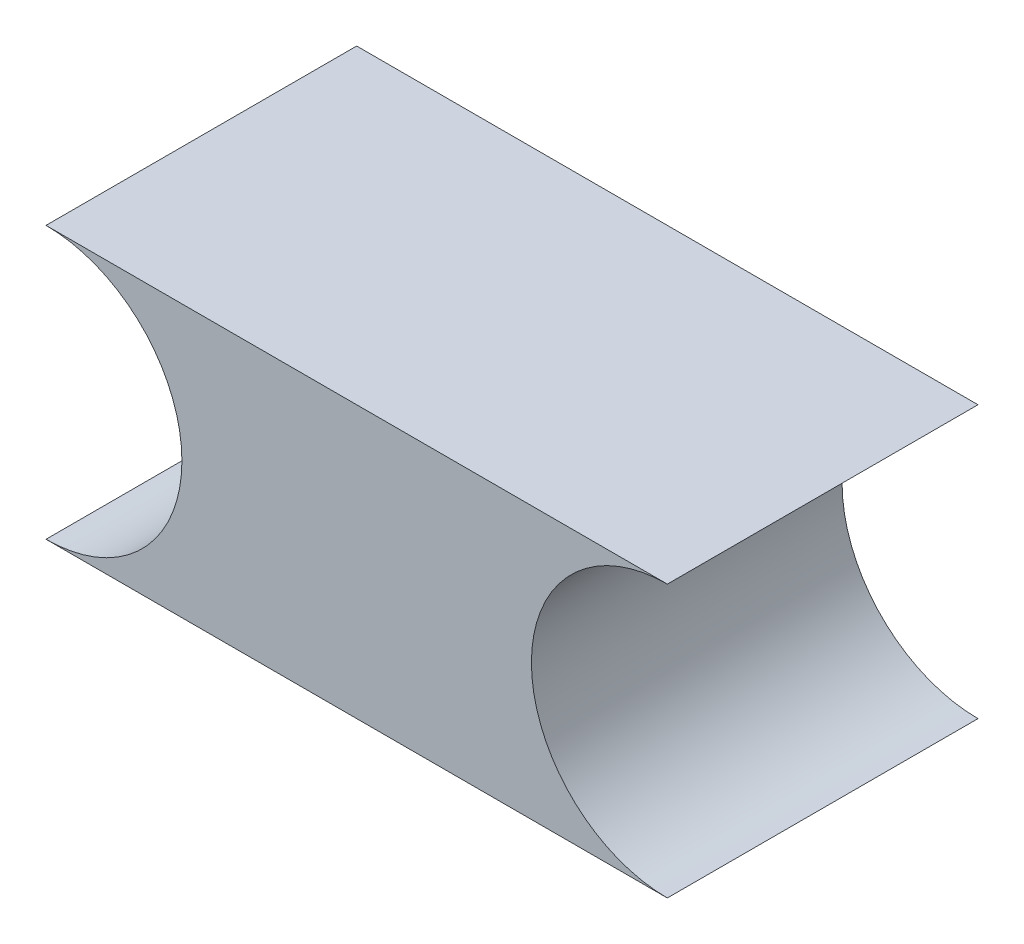
from build123d import *

# Parameters (mm, degrees)
EXTRUDE_1_DEPTH = 80


with BuildPart() as part:
    # 草图1 → 凸台-拉伸1 (new body)
    with BuildSketch(Plane.XY):
        with BuildLine():
            Line((-31.48517389, 28.82434555), (128.51482611, 28.82434555))
            ThreePointArc((128.51482611, 28.82434555), (93.51482611, -6.17565445), (128.51482611, -41.17565445))
            Line((128.51482611, -41.17565445), (-31.48517389, -41.17565445))
            ThreePointArc((-31.48517389, -41.17565445), (3.51482611, -6.17565445), (-31.48517389, 28.82434555))
        make_face()
    extrude(amount=EXTRUDE_1_DEPTH)


solid = part.part
